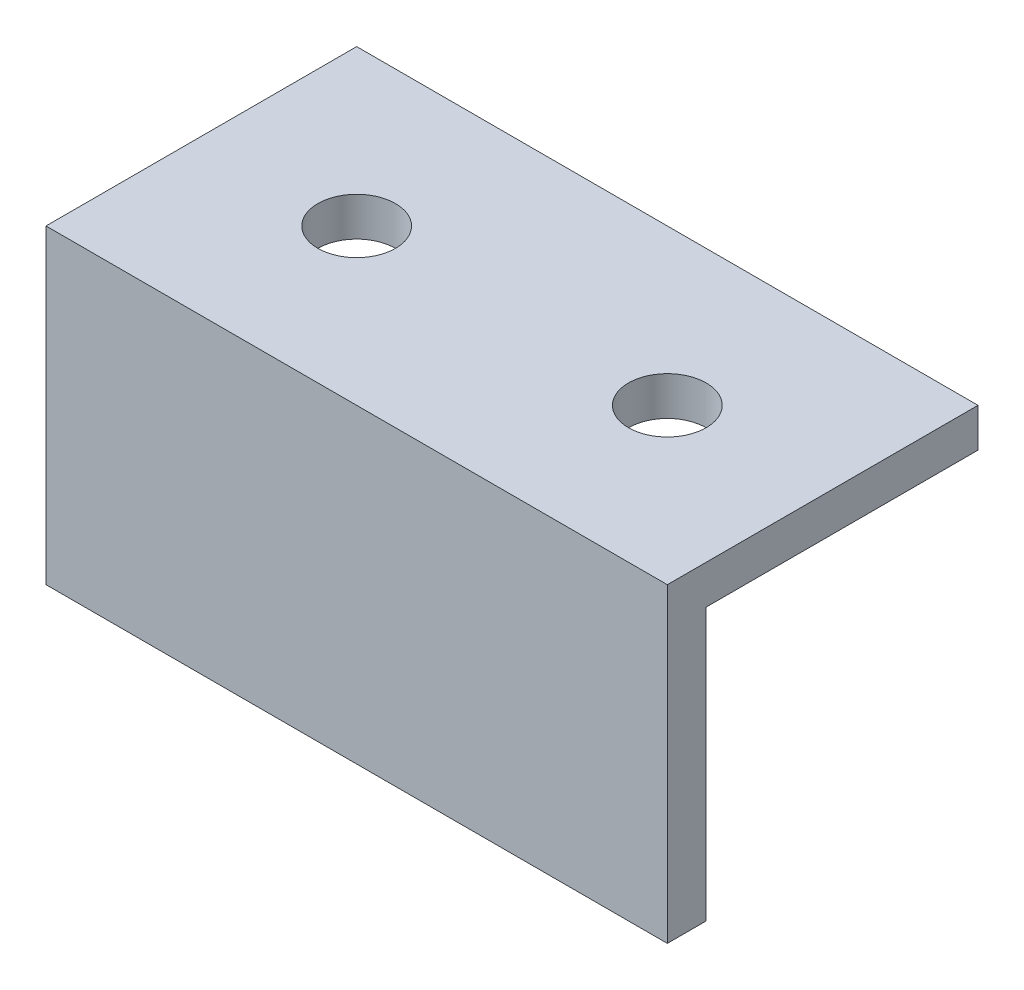
from build123d import *

# Parameters (mm, degrees)
EXTRUDE1_DEPTH = 25.4
SKETCH2_R      = 1.5875
EXTRUDE2_DEPTH = 1.5875


with BuildPart() as part:
    # Sketch1 → Extrude1 (new body)
    with BuildSketch(Plane(origin=(0, 0, 0), x_dir=(0, 0, -1), z_dir=(1, 0, 0))):
        Polygon((0, 0), (0, 12.7), (12.7, 12.7), (12.7, 11.1125), (1.5875, 11.1125), (1.5875, 0), align=None)
    extrude(amount=EXTRUDE1_DEPTH)

    # Sketch2 → Extrude2 (cut)
    with BuildSketch(Plane(origin=(0, 12.7, 0), x_dir=(1, 0, 0), z_dir=(0, 1, 0))):
        with Locations(Location((19.05, 6.35, 0), (0, 0, 270))):
            Circle(SKETCH2_R)
        with Locations(Location((6.35, 6.35, 0), (0, 0, 270))):
            Circle(SKETCH2_R)
    extrude(amount=-EXTRUDE2_DEPTH, mode=Mode.SUBTRACT)


solid = part.part
